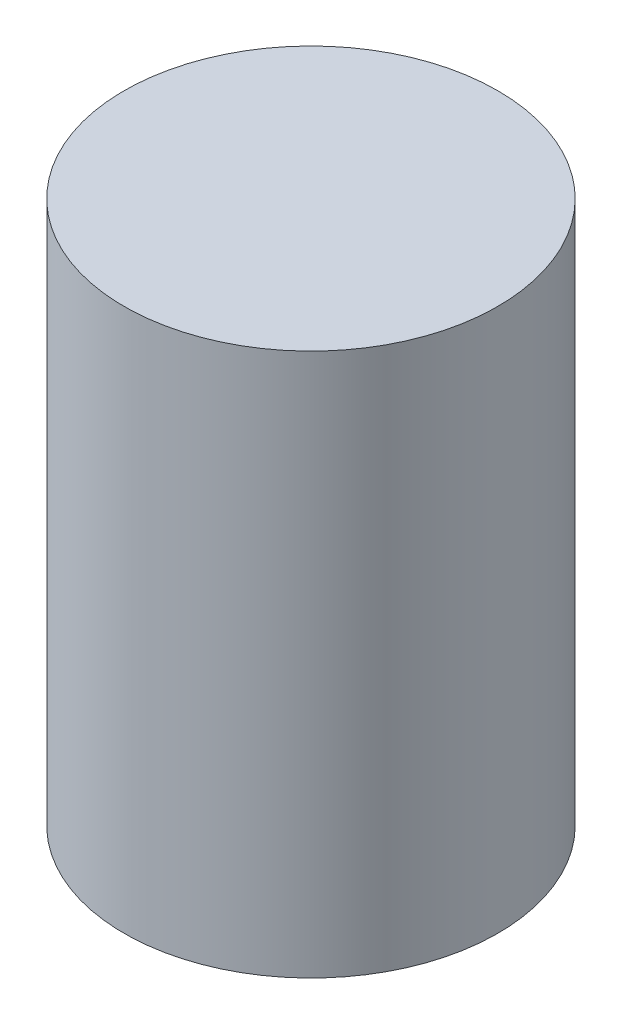
from build123d import *

# Parameters (mm, degrees)
SKETCH1_R           = 15.9000063
BOSS_EXTRUDE1_DEPTH = 46.2000092


with BuildPart() as part:
    # Sketch1 → Boss-Extrude1 (new body)
    with BuildSketch(Plane(origin=(0, 0, 0), x_dir=(1, 0, 0), z_dir=(0, 1, 0))):
        with Locations(Location((0, 0, 0), (0, 0, 90))):
            Circle(SKETCH1_R)
    extrude(amount=BOSS_EXTRUDE1_DEPTH)


solid = part.part
